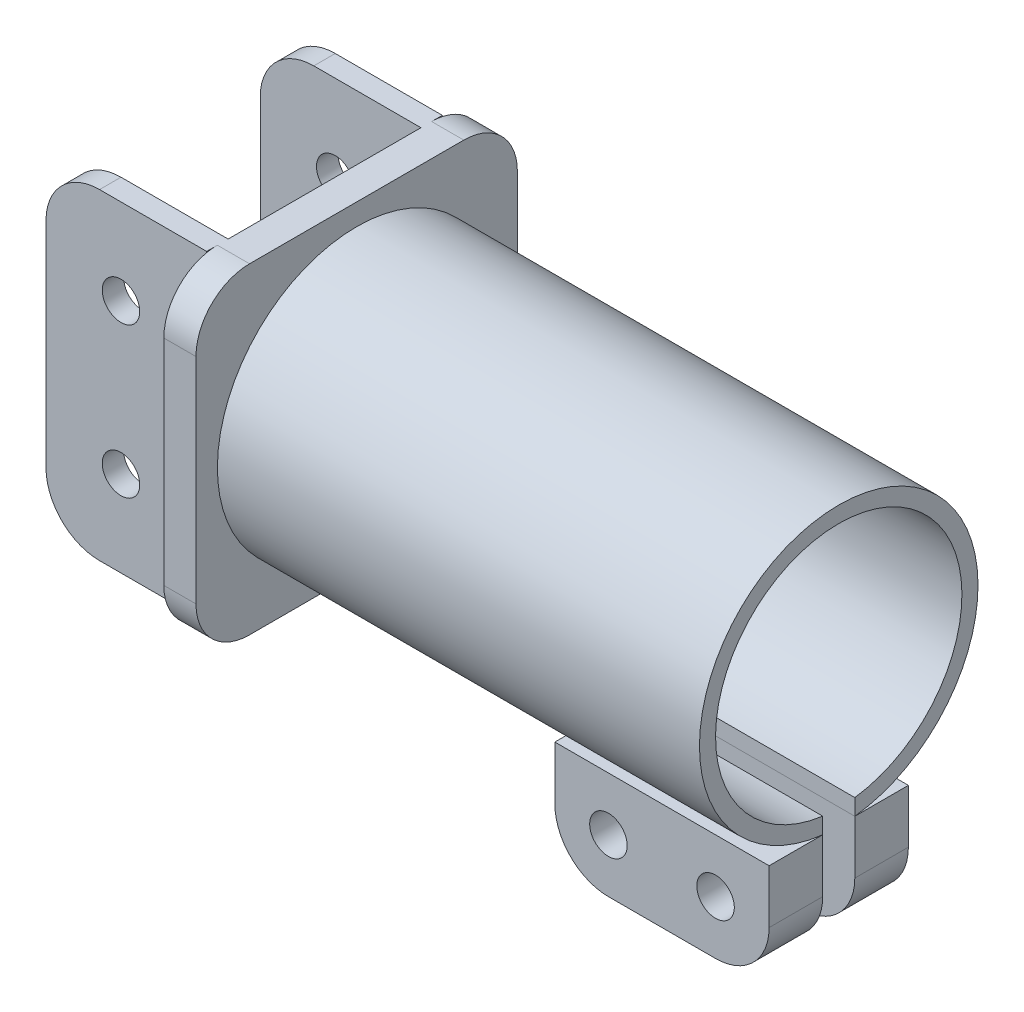
from build123d import *

# Parameters (mm, degrees)
SKETCH1_R           = 13
SKETCH1_R_2         = 11.5
EXTRUDE_THIN1_DEPTH = 45
BOSS_EXTRUDE1_DEPTH = 3
SKETCH3_W           = 2
SKETCH3_H           = 30
BOSS_EXTRUDE2_DEPTH = 15
SKETCH4_W           = 40
SKETCH4_H           = 12.318177609
CUT_EXTRUDE1_DEPTH  = 1.5
FILLET1_R           = 5
SKETCH5_R           = 1.75
CUT_EXTRUDE2_DEPTH  = 55.092513345
SKETCH6_R           = 1.75
BOSS_EXTRUDE3_DEPTH = 5
SKETCH7_R           = 1.75
BOSS_EXTRUDE4_DEPTH = 5


with BuildPart() as part:
    # Sketch1 → Extrude-Thin1 (new body)
    with BuildSketch(Plane(origin=(0, 0, 0), x_dir=(0, 0, -1), z_dir=(1, 0, 0))):
        Circle(SKETCH1_R)
        Circle(SKETCH1_R_2, mode=Mode.SUBTRACT)
    extrude(amount=EXTRUDE_THIN1_DEPTH)

    # Sketch2 → Boss-Extrude1 (add)
    with BuildSketch(Plane.ZY):
        with BuildLine():
            Line((-10, 15), (10, 15))
            ThreePointArc((10, 15), (13.535533906, 13.535533906), (15, 10))
            Line((15, 10), (15, -10))
            ThreePointArc((15, -10), (13.535533906, -13.535533906), (10, -15))
            Line((10, -15), (-10, -15))
            ThreePointArc((-10, -15), (-13.535533906, -13.535533906), (-15, -10))
            Line((-15, -10), (-15, 10))
            ThreePointArc((-15, 10), (-13.535533906, 13.535533906), (-10, 15))
        make_face()
    extrude(amount=BOSS_EXTRUDE1_DEPTH)

    # Sketch3 → Boss-Extrude2 (add)
    with BuildSketch(Plane.ZY.offset(3)):
        with Locations((-10, 0)):
            Rectangle(SKETCH3_W, SKETCH3_H)
        with Locations((10, 0)):
            Rectangle(SKETCH3_W, SKETCH3_H)
    extrude(amount=BOSS_EXTRUDE2_DEPTH)

    # Sketch4 → Cut-Extrude1 (cut, symmetric)
    with BuildSketch(Plane.XY):
        with Locations((25, -13.475339748)):
            Rectangle(SKETCH4_W, SKETCH4_H)
    extrude(amount=CUT_EXTRUDE1_DEPTH, both=True, mode=Mode.SUBTRACT)

    # Fillet1
    fillet1_edges = [part.edges().sort_by_distance(p)[0] for p in [
        (-18, -15, -10),
        (-18, 15, -10),
        (-18, 15, 10),
        (-18, -15, 10),
    ]]
    fillet(fillet1_edges, radius=FILLET1_R)

    # Sketch5 → Cut-Extrude2 (cut, through all)
    with BuildSketch(Plane.XY.offset(11)):
        with Locations(Location((-11, 7, 0), (0, 0, 90))):
            Circle(SKETCH5_R)
        with Locations(Location((-11, -7, 0), (0, 0, 90))):
            Circle(SKETCH5_R)
    extrude(amount=-CUT_EXTRUDE2_DEPTH, mode=Mode.SUBTRACT)


with BuildPart() as body_2:
    # Sketch6 → Boss-Extrude3 (new body)
    with BuildSketch(Plane.XY.offset(-1.5)):
        with BuildLine():
            Line((25, -12.91317157), (45, -12.91317157))
            Line((45, -12.91317157), (45, -17.91317157))
            ThreePointArc((45, -17.91317157), (43.535533906, -21.448705476), (40, -22.91317157))
            Line((40, -22.91317157), (30, -22.91317157))
            ThreePointArc((30, -22.91317157), (26.464466094, -21.448705476), (25, -17.91317157))
            Line((25, -17.91317157), (25, -12.91317157))
        make_face()
        with Locations((30, -17.91317157)):
            Circle(SKETCH6_R, mode=Mode.SUBTRACT)
        with Locations((40, -17.91317157)):
            Circle(SKETCH6_R, mode=Mode.SUBTRACT)
    extrude(amount=-BOSS_EXTRUDE3_DEPTH)


with BuildPart() as body_3:
    # Sketch7 → Boss-Extrude4 (new body)
    with BuildSketch(Plane(origin=(0, 0, 1.5), x_dir=(-1, 0, 0), z_dir=(0, 0, -1))):
        with BuildLine():
            Line((-25, -12.91317157), (-25, -17.91317157))
            ThreePointArc((-25, -17.91317157), (-26.464466094, -21.448705476), (-30, -22.91317157))
            Line((-30, -22.91317157), (-40, -22.91317157))
            ThreePointArc((-40, -22.91317157), (-43.535533906, -21.448705476), (-45, -17.91317157))
            Line((-45, -17.91317157), (-45, -12.91317157))
            Line((-45, -12.91317157), (-25, -12.91317157))
        make_face()
        with Locations((-30, -17.91317157)):
            Circle(SKETCH7_R, mode=Mode.SUBTRACT)
        with Locations((-40, -17.91317157)):
            Circle(SKETCH7_R, mode=Mode.SUBTRACT)
    extrude(amount=-BOSS_EXTRUDE4_DEPTH)


solid = Compound([part.part, body_2.part, body_3.part])
